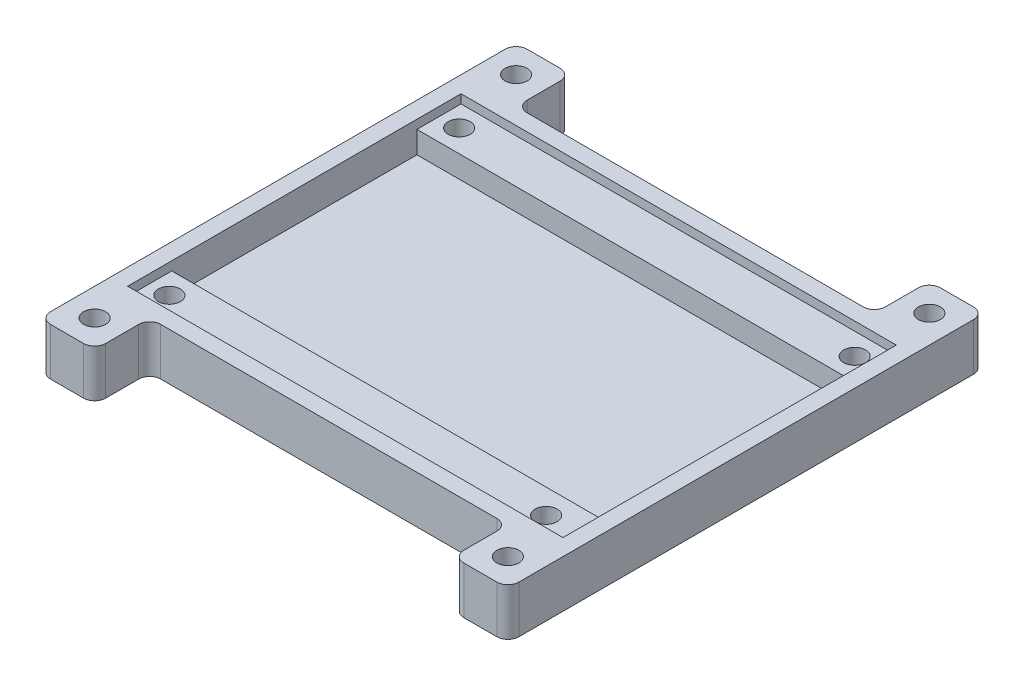
from build123d import *

# Parameters (mm, degrees)
SKETCH2_W           = 85
SKETCH2_H           = 66.5
BOSS_EXTRUDE2_DEPTH = 3
SKETCH3_W           = 85
SKETCH3_H           = 66.5
SKETCH3_W_2         = 79
SKETCH3_H_2         = 60.5
SKETCH3_H_3         = 8
BOSS_EXTRUDE3_DEPTH = 4
SKETCH4_R           = 2
CUT_EXTRUDE1_DEPTH  = 4.5
SKETCH5_W           = 85
SKETCH5_H           = 66.5
SKETCH5_W_2         = 79
SKETCH5_H_2         = 60.5
BOSS_EXTRUDE4_DEPTH = 1.6
BOSS_EXTRUDE5_START = -8.6
SKETCH6_W           = 10
SKETCH6_H           = 10
BOSS_EXTRUDE5_DEPTH = 8.6
CUT_EXTRUDE2_DEPTH  = 4.5
FILLET1_R           = 2


with BuildPart() as part:
    # Sketch2 → Boss-Extrude2 (new body)
    with BuildSketch(Plane(origin=(0, 0, 0), x_dir=(1, 0, 0), z_dir=(0, 1, 0))):
        Rectangle(SKETCH2_W, SKETCH2_H)
    extrude(amount=BOSS_EXTRUDE2_DEPTH)

    # Sketch3 → Boss-Extrude3 (add)
    # profile 1 of 3: a face of its own
    with BuildSketch(Plane(origin=(0, 3, 0), x_dir=(1, 0, 0), z_dir=(0, 1, 0))):
        Rectangle(SKETCH3_W, SKETCH3_H)
        Rectangle(SKETCH3_W_2, SKETCH3_H_2, mode=Mode.SUBTRACT)
    # profile 2 of 3: a face of its own
    with BuildSketch(Plane(origin=(0, 3, 0), x_dir=(1, 0, 0), z_dir=(0, 1, 0))):
        with Locations((0, 26.25)):
            Rectangle(SKETCH3_W_2, SKETCH3_H_3)
    # profile 3 of 3: a face of its own
    with BuildSketch(Plane(origin=(0, 3, 0), x_dir=(1, 0, 0), z_dir=(0, 1, 0))):
        with Locations((0, -26.25)):
            Rectangle(SKETCH3_W_2, SKETCH3_H_3)
    extrude(amount=BOSS_EXTRUDE3_DEPTH)

    # Sketch4 → Cut-Extrude1 (cut)
    with BuildSketch(Plane(origin=(0, 7, 0), x_dir=(1, 0, 0), z_dir=(0, 1, 0))):
        with Locations(Location((-35.89, 26.3, 0), (0, 0, 270))):
            Circle(SKETCH4_R)
        with Locations(Location((-35.89, -26.3, 0), (0, 0, 270))):
            Circle(SKETCH4_R)
        with Locations(Location((35.89, 26.3, 0), (0, 0, 270))):
            Circle(SKETCH4_R)
        with Locations(Location((32.89, -26.69684774, 0), (0, 0, 270))):
            Circle(SKETCH4_R)
    extrude(amount=-CUT_EXTRUDE1_DEPTH, mode=Mode.SUBTRACT)

    # Sketch5 → Boss-Extrude4 (add)
    with BuildSketch(Plane(origin=(0, 7, 0), x_dir=(1, 0, 0), z_dir=(0, 1, 0))):
        Rectangle(SKETCH5_W, SKETCH5_H)
        Rectangle(SKETCH5_W_2, SKETCH5_H_2, mode=Mode.SUBTRACT)
    extrude(amount=BOSS_EXTRUDE4_DEPTH)

    # Sketch6 → Boss-Extrude5 (add)
    with BuildSketch(Plane.XZ.offset(BOSS_EXTRUDE5_START)):
        with Locations((-37.5, -38.25)):
            Rectangle(SKETCH6_W, SKETCH6_H)
        with Locations((37.5, -38.25)):
            Rectangle(SKETCH6_W, SKETCH6_H)
        with Locations((37.5, 38.25)):
            Rectangle(SKETCH6_W, SKETCH6_H)
        with Locations((-37.5, 38.25)):
            Rectangle(SKETCH6_W, SKETCH6_H)
    extrude(amount=BOSS_EXTRUDE5_DEPTH)

    # Sketch7 → Cut-Extrude2 (cut)
    with BuildSketch(Plane(origin=(0, 8.6, 0), x_dir=(1, 0, 0), z_dir=(0, 1, 0))):
        with BuildLine():
            ThreePointArc((-38.914213562, 39.664213562), (-38.914213562, 36.835786438), (-36.085786438, 36.835786438))
            Line((-36.085786438, 36.835786438), (-38.914213562, 39.664213562))
        make_face()
        with BuildLine():
            Line((-38.914213562, 39.664213562), (-36.085786438, 36.835786438))
            ThreePointArc((-36.085786438, 36.835786438), (-35.652240935, 37.484633135), (-35.5, 38.25))
            ThreePointArc((-35.5, 38.25), (-36.734633135, 40.097759065), (-38.914213562, 39.664213562))
        make_face()
        with BuildLine():
            ThreePointArc((38.914213562, 39.664213562), (36.085786438, 39.664213562), (36.085786438, 36.835786438))
            Line((36.085786438, 36.835786438), (38.914213562, 39.664213562))
        make_face()
        with BuildLine():
            Line((38.914213562, 39.664213562), (36.085786438, 36.835786438))
            ThreePointArc((36.085786438, 36.835786438), (38.265366865, 36.402240935), (39.5, 38.25))
            ThreePointArc((39.5, 38.25), (39.347759065, 39.015366865), (38.914213562, 39.664213562))
        make_face()
        with BuildLine():
            ThreePointArc((39.5, -38.25), (38.265366865, -36.402240935), (36.085786438, -36.835786438))
            Line((36.085786438, -36.835786438), (38.914213562, -39.664213562))
            ThreePointArc((38.914213562, -39.664213562), (39.347759065, -39.015366865), (39.5, -38.25))
        make_face()
        with BuildLine():
            Line((38.914213562, -39.664213562), (36.085786438, -36.835786438))
            ThreePointArc((36.085786438, -36.835786438), (36.085786438, -39.664213562), (38.914213562, -39.664213562))
        make_face()
        with BuildLine():
            ThreePointArc((-36.085786438, -36.835786438), (-38.914213562, -36.835786438), (-38.914213562, -39.664213562))
            Line((-38.914213562, -39.664213562), (-36.085786438, -36.835786438))
        make_face()
        with BuildLine():
            Line((-36.085786438, -36.835786438), (-38.914213562, -39.664213562))
            ThreePointArc((-38.914213562, -39.664213562), (-36.734633135, -40.097759065), (-35.5, -38.25))
            ThreePointArc((-35.5, -38.25), (-35.652240935, -37.484633135), (-36.085786438, -36.835786438))
        make_face()
    extrude(amount=-CUT_EXTRUDE2_DEPTH, mode=Mode.SUBTRACT)

    # Fillet1
    fillet1_edges = [part.edges().sort_by_distance(p)[0] for p in [
        (42.5, 4.3, -43.25),
        (32.5, 4.3, -43.25),
        (32.5, 4.3, -33.25),
        (42.5, 4.3, 43.25),
        (32.5, 4.3, 33.25),
        (32.5, 4.3, 43.25),
        (-42.5, 4.3, 43.25),
        (-32.5, 4.3, 43.25),
        (-32.5, 4.3, 33.25),
        (-42.5, 4.3, -43.25),
        (-32.5, 4.3, -33.25),
        (-32.5, 4.3, -43.25),
    ]]
    fillet(fillet1_edges, radius=FILLET1_R)


solid = part.part
